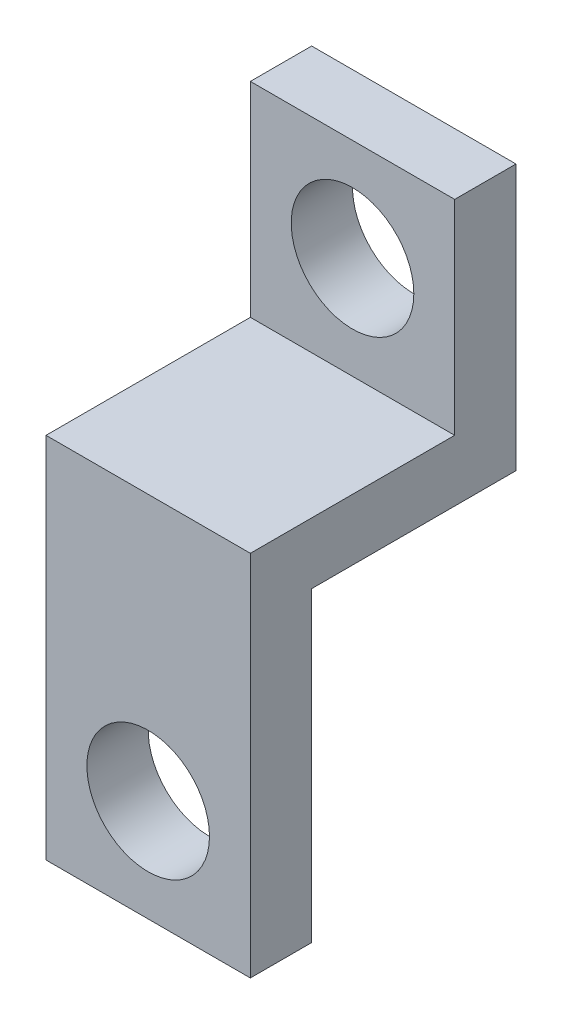
from build123d import *

# Parameters (mm, degrees)
SKETCH1_W           = 10
SKETCH1_H           = 15
SKETCH1_R           = 3
SKETCH1_H_2         = 3
BOSS_EXTRUDE1_DEPTH = 3
SKETCH1_4_W         = 10
SKETCH1_4_H         = 3
BOSS_EXTRUDE2_DEPTH = 10
BOSS_EXTRUDE3_START = -10
SKETCH1_5_W         = 10
SKETCH1_5_H         = 10
SKETCH1_5_R         = 3
BOSS_EXTRUDE3_DEPTH = 3


with BuildPart() as part:
    # Sketch1 → Boss-Extrude1 (new body)
    # profile 1 of 2: a face of its own
    with BuildSketch(Plane.XY):
        with Locations((5, -7.5)):
            Rectangle(SKETCH1_W, SKETCH1_H)
        with Locations((5, -10)):
            Circle(SKETCH1_R, mode=Mode.SUBTRACT)
    # profile 2 of 2: a face of its own
    with BuildSketch(Plane.XY):
        with Locations((5, 1.5)):
            Rectangle(SKETCH1_W, SKETCH1_H_2)
    extrude(amount=BOSS_EXTRUDE1_DEPTH)

    # Sketch1<4> → Boss-Extrude2 (add)
    with BuildSketch(Plane.XY):
        with Locations((5, 1.5)):
            Rectangle(SKETCH1_4_W, SKETCH1_4_H)
    extrude(amount=-BOSS_EXTRUDE2_DEPTH)

    # Sketch1<5> → Boss-Extrude3 (add)
    with BuildSketch(Plane.XY.offset(BOSS_EXTRUDE3_START)):
        with Locations((5, 8)):
            Rectangle(SKETCH1_5_W, SKETCH1_5_H)
        with Locations((5, 8)):
            Circle(SKETCH1_5_R, mode=Mode.SUBTRACT)
    extrude(amount=BOSS_EXTRUDE3_DEPTH)


solid = part.part
